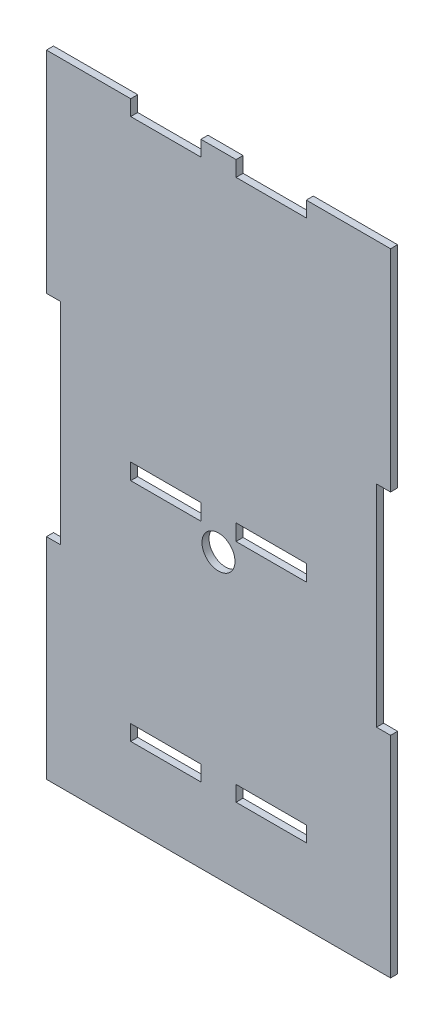
from build123d import *

# Parameters (mm, degrees)
MODEL_R         = 2.35
MODEL_W         = 10
MODEL_H         = 2.3
MODEL_H_2       = 2.20013503
EXTRUDE_1_DEPTH = 1


with BuildPart() as part:
    # Model → 凸台-拉伸1 (new body)
    with BuildSketch(Plane.XY):
        Polygon((3.002178354, 2.656404454), (33.252178354, 2.656404454), (52.002178354, 2.656404454), (52.002178354, 32.582558285), (50.002178354, 32.582558285), (50.002178354, 62.582558285), (52.002178354, 62.582558285), (52.002178354, 92.582558285), (40.002178354, 92.582558285), (40.002178354, 90.382558285), (30.002178354, 90.382558285), (30.002178354, 92.582558285), (25.002178354, 92.582558285), (25.002178354, 90.382558285), (15.002178354, 90.382558285), (15.002178354, 92.582558285), (3.002178354, 92.582558285), (3.002178354, 62.582558285), (5.002178354, 62.582558285), (5.002178354, 32.582558285), (3.002178354, 32.582558285), align=None)
        with Locations((27.502178354, 42.933185696)):
            Circle(MODEL_R, mode=Mode.SUBTRACT)
        with Locations((20.002178354, 46.632557075)):
            Rectangle(MODEL_W, MODEL_H, mode=Mode.SUBTRACT)
        with Locations((20.002178354, 14.429981905)):
            Rectangle(MODEL_W, MODEL_H_2, mode=Mode.SUBTRACT)
        with Locations((35.002178354, 14.429981905)):
            Rectangle(MODEL_W, MODEL_H_2, mode=Mode.SUBTRACT)
        with Locations((35.002178354, 46.632557075)):
            Rectangle(MODEL_W, MODEL_H, mode=Mode.SUBTRACT)
    extrude(amount=EXTRUDE_1_DEPTH)


solid = part.part
